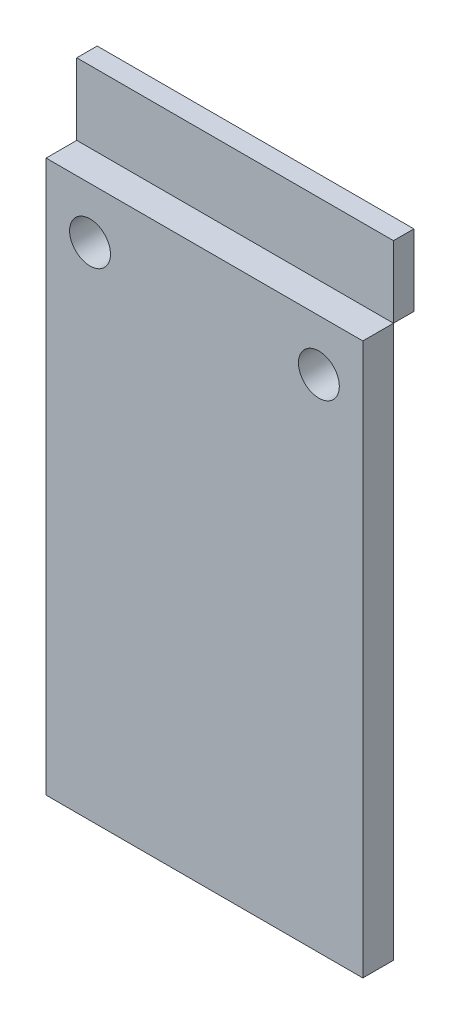
from build123d import *

# Parameters (mm, degrees)
SZKIC1_W                    = 15.5
SZKIC1_H                    = 27
SZKIC1_R                    = 1
DODANIE_WYCI_GNI_CIE1_DEPTH = 1.5
SZKIC2_W                    = 15.5
SZKIC2_H                    = 3.5
DODANIE_WYCI_GNI_CIE2_DEPTH = 1


with BuildPart() as part:
    # Szkic1 → Dodanie-wyciągnięcie1 (new body)
    with BuildSketch(Plane.XY):
        Rectangle(SZKIC1_W, SZKIC1_H)
        with Locations((-5.6, 11)):
            Circle(SZKIC1_R, mode=Mode.SUBTRACT)
        with Locations((5.6, 11)):
            Circle(SZKIC1_R, mode=Mode.SUBTRACT)
    extrude(amount=DODANIE_WYCI_GNI_CIE1_DEPTH)


with BuildPart() as body_2:
    # Szkic2 → Dodanie-wyciągnięcie2 (new body)
    with BuildSketch(Plane(origin=(0, 0, 0), x_dir=(-1, 0, 0), z_dir=(0, 0, -1))):
        with Locations((0, 15.25)):
            Rectangle(SZKIC2_W, SZKIC2_H)
    extrude(amount=DODANIE_WYCI_GNI_CIE2_DEPTH)


solid = Compound([part.part, body_2.part])
